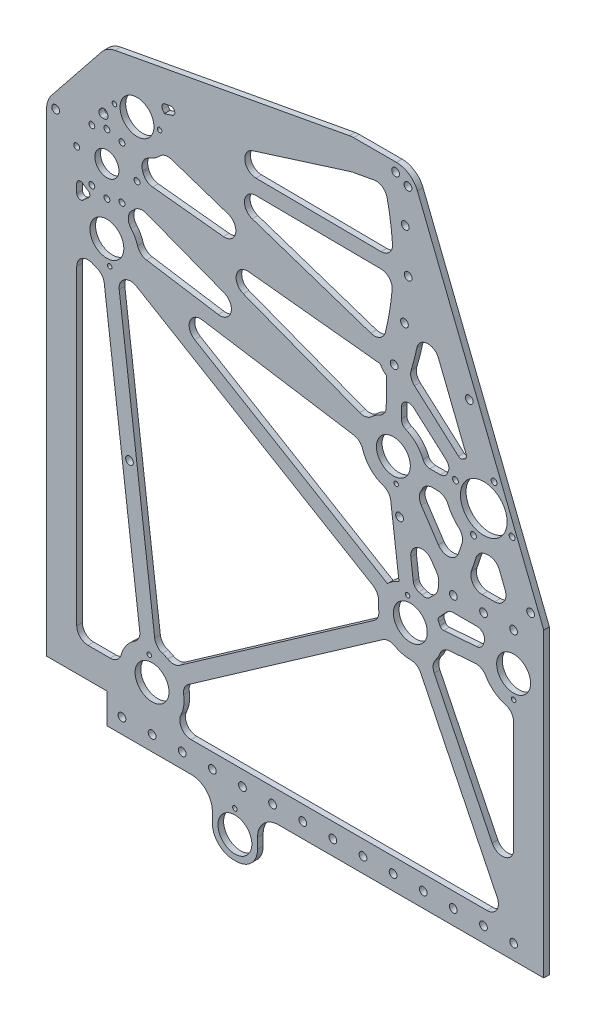
from build123d import *

# Parameters (mm, degrees)
SKETCH1_R           = 14.2875
SKETCH1_R_2         = 3.2639
SKETCH1_R_3         = 1.89865
SKETCH1_R_4         = 2.4892
SKETCH1_R_5         = 10.16
SKETCH1_R_6         = 19.685
BOSS_EXTRUDE1_DEPTH = 4.7625
CUT_EXTRUDE1_DEPTH  = 642.084706888


with BuildPart() as part:
    # Sketch1 → Boss-Extrude1 (new body)
    with BuildSketch(Plane.XY):
        with BuildLine():
            Line((0, 0), (58.42, 0))
            ThreePointArc((58.42, 0), (70.992358569, -5.207641431), (76.2, -17.78))
            Line((76.2, -17.78), (76.2, -26.67))
            ThreePointArc((76.2, -26.67), (81.407641431, -39.242358569), (93.98, -44.45))
            Line((93.98, -44.45), (96.52, -44.45))
            ThreePointArc((96.52, -44.45), (109.092358569, -39.242358569), (114.3, -26.67))
            Line((114.3, -26.67), (114.3, -17.78))
            ThreePointArc((114.3, -17.78), (119.507641431, -5.207641431), (132.08, 0))
            Line((132.08, 0), (355.6, 0))
            Line((355.6, 0), (355.6, 254))
            Line((355.6, 254), (249.10117554, 521.398701085))
            ThreePointArc((249.10117554, 521.398701085), (242.094897124, 530.116741193), (231.403200712, 533.4))
            Line((231.403200712, 533.4), (195.266336953, 533.4))
            ThreePointArc((195.266336953, 533.4), (193.528606236, 533.320577006), (191.805365363, 533.082970284))
            Line((191.805365363, 533.082970284), (-5.719746514, 496.589622449))
            ThreePointArc((-5.719746514, 496.589622449), (-12.042837413, 494.202129252), (-17.134325743, 489.757092821))
            Line((-17.134325743, 489.757092821), (-59.32555082, 437.018061475))
            ThreePointArc((-59.32555082, 437.018061475), (-62.42611948, 431.423303054), (-63.5, 425.117620819))
            Line((-63.5, 425.117620819), (-63.5, 25.4))
            Line((-63.5, 25.4), (-12.7, 25.4))
            Line((-12.7, 25.4), (-12.7, 0))
            Line((-12.7, 0), (0, 0))
        make_face()
        with Locations(Location((12.7, 457.2, 0), (0, 0, 180))):
            Circle(SKETCH1_R, mode=Mode.SUBTRACT)
        with Locations(Location((0, 12.7, 0), (0, 0, 180))):
            Circle(SKETCH1_R_2, mode=Mode.SUBTRACT)
        with Locations(Location((95.25, -25.4, 0), (0, 0, 180))):
            Circle(SKETCH1_R, mode=Mode.SUBTRACT)
        with Locations(Location((95.25, -6.35, 0), (0, 0, 180))):
            Circle(SKETCH1_R_3, mode=Mode.SUBTRACT)
        with Locations(Location((330.2, 209.55, 0), (0, 0, 180))):
            Circle(SKETCH1_R, mode=Mode.SUBTRACT)
        with Locations(Location((330.2, 241.3, 0), (0, 0, 180))):
            Circle(SKETCH1_R_2, mode=Mode.SUBTRACT)
        with Locations(Location((304.8, 241.3, 0), (0, 0, 180))):
            Circle(SKETCH1_R_2, mode=Mode.SUBTRACT)
        with Locations(Location((279.4, 241.3, 0), (0, 0, 180))):
            Circle(SKETCH1_R_2, mode=Mode.SUBTRACT)
        with Locations(Location((330.2, 190.5, 0), (0, 0, 180))):
            Circle(SKETCH1_R_3, mode=Mode.SUBTRACT)
        with Locations(Location((-6.35, 457.2, 0), (0, 0, 180))):
            Circle(SKETCH1_R_3, mode=Mode.SUBTRACT)
        with Locations(Location((31.75, 457.2, 0), (0, 0, 180))):
            Circle(SKETCH1_R_3, mode=Mode.SUBTRACT)
        with Locations(Location((-12.7, 435.695889306, 0), (0, 0, 180))):
            Circle(SKETCH1_R_4, mode=Mode.SUBTRACT)
        with Locations(Location((12.7, 410.295889306, 0), (0, 0, 180))):
            Circle(SKETCH1_R_4, mode=Mode.SUBTRACT)
        with Locations(Location((-12.7, 384.895889306, 0), (0, 0, 180))):
            Circle(SKETCH1_R_4, mode=Mode.SUBTRACT)
        with Locations(Location((-12.7, 410.295889306, 0), (0, 0, 180))):
            Circle(SKETCH1_R_5, mode=Mode.SUBTRACT)
        with Locations(Location((305.040932245, 317.5, 0), (0, 0, 180))):
            Circle(SKETCH1_R_6, mode=Mode.SUBTRACT)
        with Locations(Location((-12.7, 355.6, 0), (0, 0, 180))):
            Circle(SKETCH1_R, mode=Mode.SUBTRACT)
        with Locations(Location((25.4, 50.8, 0), (0, 0, 180))):
            Circle(SKETCH1_R, mode=Mode.SUBTRACT)
        with Locations(Location((228.840932245, 317.5, 0), (0, 0, 180))):
            Circle(SKETCH1_R, mode=Mode.SUBTRACT)
        with Locations(Location((243.128432245, 203.2, 0), (0, 0, 180))):
            Circle(SKETCH1_R, mode=Mode.SUBTRACT)
        with Locations(Location((313.728243886, 341.368192568, 0), (0, 0, 180))):
            Circle(SKETCH1_R_4, mode=Mode.SUBTRACT)
        with Locations(Location((328.909124813, 308.81268836, 0), (0, 0, 180))):
            Circle(SKETCH1_R_4, mode=Mode.SUBTRACT)
        with Locations(Location((296.353620605, 293.631807432, 0), (0, 0, 180))):
            Circle(SKETCH1_R_4, mode=Mode.SUBTRACT)
        with Locations(Location((281.172739677, 326.18731164, 0), (0, 0, 180))):
            Circle(SKETCH1_R_4, mode=Mode.SUBTRACT)
        with Locations(Location((241.146330981, 520.7, 0), (0, 0, 180))):
            Circle(SKETCH1_R_2, mode=Mode.SUBTRACT)
        with Locations(Location((6.35, 203.2, 0), (0, 0, 180))):
            Circle(SKETCH1_R_2, mode=Mode.SUBTRACT)
        with Locations(Location((234.039227972, 275.913634187, 0), (0, 0, 180))):
            Circle(SKETCH1_R_2, mode=Mode.SUBTRACT)
        with Locations(Location((25.4, 12.7, 0), (0, 0, 180))):
            Circle(SKETCH1_R_2, mode=Mode.SUBTRACT)
        with Locations(Location((50.8, 12.7, 0), (0, 0, 180))):
            Circle(SKETCH1_R_2, mode=Mode.SUBTRACT)
        with Locations(Location((0, 388.29884405, 0), (0, 0, 180))):
            Circle(SKETCH1_R_4, mode=Mode.SUBTRACT)
        with Locations(Location((-25.4, 388.29884405, 0), (0, 0, 180))):
            Circle(SKETCH1_R_4, mode=Mode.SUBTRACT)
        with Locations(Location((-10.337138306, 336.697106449, 0), (0, 0, 180))):
            Circle(SKETCH1_R_3, mode=Mode.SUBTRACT)
        with Locations(Location((23.037138306, 69.702893551, 0), (0, 0, 180))):
            Circle(SKETCH1_R_3, mode=Mode.SUBTRACT)
        with Locations(Location((231.203793939, 298.597106449, 0), (0, 0, 180))):
            Circle(SKETCH1_R_3, mode=Mode.SUBTRACT)
        with Locations(Location((240.765570551, 222.102893551, 0), (0, 0, 180))):
            Circle(SKETCH1_R_3, mode=Mode.SUBTRACT)
        with Locations(Location((292.836805605, 390.914851261, 0), (0, 0, 180))):
            Circle(SKETCH1_R_2, mode=Mode.SUBTRACT)
        with Locations(Location((344.52728023, 261.129702523, 0), (0, 0, 180))):
            Circle(SKETCH1_R_2, mode=Mode.SUBTRACT)
        with Locations(Location((229.48678758, 384.664155546, 0), (0, 0, 180))):
            Circle(SKETCH1_R_2, mode=Mode.SUBTRACT)
        with Locations(Location((238.164888511, 419.4701173, 0), (0, 0, 180))):
            Circle(SKETCH1_R_2, mode=Mode.SUBTRACT)
        with Locations(Location((241.291295612, 455.205113985, 0), (0, 0, 180))):
            Circle(SKETCH1_R_2, mode=Mode.SUBTRACT)
        with Locations(Location((238.789026365, 490.989231384, 0), (0, 0, 180))):
            Circle(SKETCH1_R_2, mode=Mode.SUBTRACT)
        with Locations(Location((230.719694941, 525.941345767, 0), (0, 0, 180))):
            Circle(SKETCH1_R_2, mode=Mode.SUBTRACT)
        with Locations(Location((-55.88, 428.625, 0), (0, 0, 180))):
            Circle(SKETCH1_R_2, mode=Mode.SUBTRACT)
        with Locations(Location((76.2, 12.7, 0), (0, 0, 180))):
            Circle(SKETCH1_R_2, mode=Mode.SUBTRACT)
        with Locations(Location((101.6, 12.7, 0), (0, 0, 180))):
            Circle(SKETCH1_R_2, mode=Mode.SUBTRACT)
        with Locations(Location((127, 12.7, 0), (0, 0, 180))):
            Circle(SKETCH1_R_2, mode=Mode.SUBTRACT)
        with Locations(Location((152.4, 12.7, 0), (0, 0, 180))):
            Circle(SKETCH1_R_2, mode=Mode.SUBTRACT)
        with Locations(Location((177.8, 12.7, 0), (0, 0, 180))):
            Circle(SKETCH1_R_2, mode=Mode.SUBTRACT)
        with Locations(Location((203.2, 12.7, 0), (0, 0, 180))):
            Circle(SKETCH1_R_2, mode=Mode.SUBTRACT)
        with Locations(Location((228.6, 12.7, 0), (0, 0, 180))):
            Circle(SKETCH1_R_2, mode=Mode.SUBTRACT)
        with Locations(Location((254, 12.7, 0), (0, 0, 180))):
            Circle(SKETCH1_R_2, mode=Mode.SUBTRACT)
        with Locations(Location((279.4, 12.7, 0), (0, 0, 180))):
            Circle(SKETCH1_R_2, mode=Mode.SUBTRACT)
        with Locations(Location((304.8, 12.7, 0), (0, 0, 180))):
            Circle(SKETCH1_R_2, mode=Mode.SUBTRACT)
        with Locations(Location((330.2, 12.7, 0), (0, 0, 180))):
            Circle(SKETCH1_R_2, mode=Mode.SUBTRACT)
        with Locations(Location((-38.1, 410.295889306, 0), (0, 0, 180))):
            Circle(SKETCH1_R_4, mode=Mode.SUBTRACT)
        with Locations(Location((-25.4, 432.292934562, 0), (0, 0, 180))):
            Circle(SKETCH1_R_4, mode=Mode.SUBTRACT)
        with Locations(Location((0, 432.292934562, 0), (0, 0, 180))):
            Circle(SKETCH1_R_4, mode=Mode.SUBTRACT)
    extrude(amount=BOSS_EXTRUDE1_DEPTH)

    # Sketch2 → Cut-Extrude1 (cut, through all)
    with BuildSketch(Plane.XY.offset(4.7625)):
        with BuildLine():
            Line((-38.1, 60.325), (-38.1, 322.719199656))
            ThreePointArc((-38.1, 322.719199656), (-33.638580803, 330.786775157), (-24.433695652, 331.296799746))
            ThreePointArc((-24.433695652, 331.296799746), (-22.900882798, 330.614661371), (-21.328645615, 330.029086229))
            ThreePointArc((-21.328645615, 330.029086229), (-16.996833162, 327.029196632), (-14.922603173, 322.185488686))
            Line((-14.922603173, 322.185488686), (15.020674139, 82.639270185))
            ThreePointArc((15.020674139, 82.639270185), (14.202563952, 77.434019717), (10.742472399, 73.46014212))
            ThreePointArc((10.742472399, 73.46014212), (3.597868561, 66.705729187), (-0.653032363, 57.840217391))
            ThreePointArc((-0.653032363, 57.840217391), (-4.057794078, 52.762157302), (-9.848220256, 50.8))
            Line((-9.848220256, 50.8), (-28.575, 50.8))
            ThreePointArc((-28.575, 50.8), (-35.310192091, 53.589807909), (-38.1, 60.325))
        make_face()
        with BuildLine():
            Line((-18.799176664, 447.016190262), (-17.864744515, 448.184230449))
            ThreePointArc((-17.864744515, 448.184230449), (-14.908714143, 449.339822487), (-12.429119093, 447.358631707))
            ThreePointArc((-12.429119093, 447.358631707), (-12.2388309, 446.885938258), (-12.039651987, 446.416921783))
            ThreePointArc((-12.039651987, 446.416921783), (-12.239530994, 443.495175095), (-14.745635708, 441.97992116))
            ThreePointArc((-14.745635708, 441.97992116), (-15.368752024, 441.933529272), (-15.990834722, 441.874884015))
            ThreePointArc((-15.990834722, 441.874884015), (-19.106326386, 443.510760362), (-18.799176664, 447.016190262))
        make_face()
        with BuildLine():
            Line((36.19057906, 478.502818876), (40.824911192, 479.359025425))
            ThreePointArc((40.824911192, 479.359025425), (44.482646234, 477.004092806), (42.356480703, 473.208812393))
            Line((42.356480703, 473.208812393), (35.80632756, 471.14355704))
            ThreePointArc((35.80632756, 471.14355704), (35.050371679, 472.325674929), (34.233996326, 473.466903777))
            ThreePointArc((34.233996326, 473.466903777), (33.807929946, 476.530490485), (36.19057906, 478.502818876))
        make_face()
        with BuildLine():
            Line((266.824182793, 408.252842493), (290.231086719, 349.482468849))
            ThreePointArc((290.231086719, 349.482468849), (290.280530625, 347.265578846), (288.867094604, 345.556999144))
            ThreePointArc((288.867094604, 345.556999144), (288.170576423, 345.143793506), (287.484608388, 344.713300381))
            ThreePointArc((287.484608388, 344.713300381), (285.519595212, 344.215645611), (283.653958733, 345.008323085))
            Line((283.653958733, 345.008323085), (246.600461466, 377.947175943))
            ThreePointArc((246.600461466, 377.947175943), (243.764810838, 382.46848463), (243.806173651, 387.80528478))
            ThreePointArc((243.806173651, 387.80528478), (246.425000245, 397.214049473), (248.660947453, 406.721080864))
            ThreePointArc((248.660947453, 406.721080864), (257.174764084, 414.21980033), (266.824182793, 408.252842493))
        make_face()
        with BuildLine():
            Line((307.859067954, 25.4), (58.280800344, 25.4))
            ThreePointArc((58.280800344, 25.4), (50.213224843, 29.861419197), (49.703200254, 39.066304348))
            ThreePointArc((49.703200254, 39.066304348), (52.106434653, 46.91522145), (52.038922024, 55.123539018))
            ThreePointArc((52.038922024, 55.123539018), (52.666309831, 60.355204265), (55.978903868, 64.452844739))
            Line((55.978903868, 64.452844739), (219.832182558, 179.142687562))
            ThreePointArc((219.832182558, 179.142687562), (224.816259843, 180.85233967), (229.946588598, 179.650814148))
            ThreePointArc((229.946588598, 179.650814148), (236.390004583, 177.067285849), (243.279292634, 176.212921659))
            ThreePointArc((243.279292634, 176.212921659), (248.350941339, 174.783825397), (251.886853617, 170.877258991))
            Line((251.886853617, 170.877258991), (316.413384094, 39.114188511))
            ThreePointArc((316.413384094, 39.114188511), (315.940764731, 29.883987977), (307.859067954, 25.4))
        make_face()
        with BuildLine():
            Line((303.628265017, 254), (314.213336557, 254))
            ThreePointArc((314.213336557, 254), (322.096707153, 258.179151794), (323.062323971, 267.049350543))
            Line((323.062323971, 267.049350543), (318.169842434, 279.333459918))
            ThreePointArc((318.169842434, 279.333459918), (314.256652531, 283.955490654), (308.348145298, 285.28431179))
            ThreePointArc((308.348145298, 285.28431179), (307.728913526, 285.226745103), (307.108690506, 285.181079833))
            ThreePointArc((307.108690506, 285.181079833), (301.914252062, 283.229019405), (298.689245961, 278.71326185))
            Line((298.689245961, 278.71326185), (294.600656278, 266.562746772))
            ThreePointArc((294.600656278, 266.562746772), (295.893274293, 257.966624023), (303.628265017, 254))
        make_face()
        with BuildLine():
            Line((279.4, 228.6), (299.376325556, 228.6))
            ThreePointArc((299.376325556, 228.6), (304.652851514, 225.782813866), (305.24750164, 219.830952381))
            ThreePointArc((305.24750164, 219.830952381), (304.889888033, 218.916076472), (304.565805272, 217.988792382))
            ThreePointArc((304.565805272, 217.988792382), (302.441476402, 214.968801127), (298.996099488, 213.641209982))
            Line((298.996099488, 213.641209982), (271.209822072, 211.614798076))
            ThreePointArc((271.209822072, 211.614798076), (269.31406891, 212.077871306), (268.047260495, 213.562294866))
            ThreePointArc((268.047260495, 213.562294866), (267.529427929, 214.728944701), (266.957011707, 215.869804934))
            ThreePointArc((266.957011707, 215.869804934), (266.614718788, 217.791042146), (267.460809703, 219.549577625))
            Line((267.460809703, 219.549577625), (274.208695443, 226.637621032))
            ThreePointArc((274.208695443, 226.637621032), (276.396893604, 228.133720202), (279.005216021, 228.606137483))
            ThreePointArc((279.005216021, 228.606137483), (279.202584158, 228.601534463), (279.4, 228.6))
        make_face()
        with BuildLine():
            Line((223.843870327, 222.079375728), (61.310257234, 318.902556865))
            ThreePointArc((61.310257234, 318.902556865), (57.227247599, 330.323556905), (67.669100269, 336.494288014))
            Line((67.669100269, 336.494288014), (195.372309265, 316.350736287))
            ThreePointArc((195.372309265, 316.350736287), (200.146965701, 314.122150942), (203.00631261, 309.696309557))
            ThreePointArc((203.00631261, 309.696309557), (209.454139857, 298.72561753), (220.212286631, 291.929086229))
            ThreePointArc((220.212286631, 291.929086229), (224.544099083, 288.929196632), (226.618329072, 284.085488686))
            Line((226.618329072, 284.085488686), (233.57406086, 228.439634381))
            ThreePointArc((233.57406086, 228.439634381), (228.362449682, 225.789619634), (223.843870327, 222.079375728))
        make_face()
        with BuildLine():
            Line((12.298525281, 333.316749227), (211.630246523, 214.57250313))
            ThreePointArc((211.630246523, 214.57250313), (215.23455266, 210.728948267), (216.244091901, 205.557413945))
            ThreePointArc((216.244091901, 205.557413945), (216.159122155, 202.209308581), (216.489510221, 198.876460982))
            ThreePointArc((216.489510221, 198.876460982), (215.862122415, 193.644795735), (212.549528377, 189.547155261))
            Line((212.549528377, 189.547155261), (48.696249688, 74.857312438))
            ThreePointArc((48.696249688, 74.857312438), (43.712172403, 73.14766033), (38.581843648, 74.349185852))
            ThreePointArc((38.581843648, 74.349185852), (36.351995545, 75.465339038), (34.028645615, 76.370913771))
            ThreePointArc((34.028645615, 76.370913771), (29.696833162, 79.370803368), (27.622603173, 84.214511314))
            Line((27.622603173, 84.214511314), (-2.320674139, 323.760729815))
            ThreePointArc((-2.320674139, 323.760729815), (-1.502563952, 328.965980283), (1.957527601, 332.93985788))
            ThreePointArc((1.957527601, 332.93985788), (2.065982563, 333.010380366), (2.174098224, 333.08142193))
            ThreePointArc((2.174098224, 333.08142193), (7.202445228, 334.656116543), (12.298525281, 333.316749227))
        make_face()
        with BuildLine():
            Line((263.292608469, 176.462843673), (312.12068386, 76.755992994))
            ThreePointArc((312.12068386, 76.755992994), (322.825088809, 71.666025126), (330.2, 80.945181505))
            Line((330.2, 80.945181505), (330.2, 174.301779744))
            ThreePointArc((330.2, 174.301779744), (328.237842698, 180.092205922), (323.159782609, 183.496967637))
            ThreePointArc((323.159782609, 183.496967637), (313.737608962, 188.165079201), (306.814626608, 196.07968198))
            ThreePointArc((306.814626608, 196.07968198), (303.024336294, 199.739960118), (297.86816124, 200.825223002))
            Line((297.86816124, 200.825223002), (276.384009899, 199.258415782))
            ThreePointArc((276.384009899, 199.258415782), (271.439847396, 197.436550295), (268.220714464, 193.265085339))
            ThreePointArc((268.220714464, 193.265085339), (266.531184332, 189.759897656), (264.355143992, 186.534110745))
            ThreePointArc((264.355143992, 186.534110745), (262.37449565, 181.651389285), (263.292608469, 176.462843673))
        make_face()
        with BuildLine():
            Line((20.76862298, 356.749263713), (81.284151638, 347.203711245))
            ThreePointArc((81.284151638, 347.203711245), (91.969128506, 354.14875677), (86.184174765, 365.503786415))
            Line((86.184174765, 365.503786415), (20.5883354, 390.704584442))
            ThreePointArc((20.5883354, 390.704584442), (15.082567769, 391.106090133), (10.278776905, 388.386112677))
            ThreePointArc((10.278776905, 388.386112677), (9.402605923, 387.50252818), (8.492485051, 386.653954584))
            ThreePointArc((8.492485051, 386.653954584), (5.343572324, 380.152199071), (7.663213897, 373.310580907))
            ThreePointArc((7.663213897, 373.310580907), (10.924067716, 368.64716754), (13.134619636, 363.403690443))
            ThreePointArc((13.134619636, 363.403690443), (15.993966545, 358.977849058), (20.76862298, 356.749263713))
        make_face()
        with BuildLine():
            Line((102.332438022, 372.904893306), (200.424619589, 335.219557169))
            ThreePointArc((200.424619589, 335.219557169), (205.674047392, 334.764096458), (210.36238516, 337.168971856))
            ThreePointArc((210.36238516, 337.168971856), (213.66525321, 339.816449584), (217.341469568, 341.91490353))
            ThreePointArc((217.341469568, 341.91490353), (221.301348703, 345.3910068), (222.807395329, 350.440339457))
            Line((222.807395329, 350.440339457), (223.031323456, 373.727200625))
            ThreePointArc((223.031323456, 373.727200625), (220.005048323, 376.215095205), (217.88103223, 379.506981633))
            Line((217.88103223, 379.506981633), (106.750838987, 391.268397499))
            ThreePointArc((106.750838987, 391.268397499), (96.48765307, 384.024496514), (102.332438022, 372.904893306))
        make_face()
        with BuildLine():
            Line((259.782663126, 229.903145882), (264.07598925, 234.412896506))
            ThreePointArc((264.07598925, 234.412896506), (266.046572769, 237.507542886), (266.70131221, 241.117439268))
            ThreePointArc((266.70131221, 241.117439268), (266.748590381, 242.409880464), (266.927068545, 243.690811772))
            ThreePointArc((266.927068545, 243.690811772), (266.910869371, 247.35956813), (265.509212287, 250.750053794))
            Line((265.509212287, 250.750053794), (260.912298524, 257.678283373))
            ThreePointArc((260.912298524, 257.678283373), (249.663919213, 261.342959094), (243.524009416, 251.230719334))
            Line((243.524009416, 251.230719334), (245.606190484, 234.573270795))
            ThreePointArc((245.606190484, 234.573270795), (247.109566657, 231.200885821), (250.235017333, 229.235007291))
            ThreePointArc((250.235017333, 229.235007291), (251.572479808, 228.832464123), (252.887324578, 228.361263416))
            ThreePointArc((252.887324578, 228.361263416), (256.569250576, 228.08460248), (259.782663126, 229.903145882))
        make_face()
        with BuildLine():
            Line((283.724892869, 274.063491541), (286.652434309, 282.763590879))
            ThreePointArc((286.652434309, 282.763590879), (286.813424876, 288.310374874), (283.855758905, 293.005579094))
            ThreePointArc((283.855758905, 293.005579094), (278.741963784, 298.601521679), (275.069148501, 305.232954545))
            ThreePointArc((275.069148501, 305.232954545), (271.562395074, 309.533583693), (266.253917988, 311.15))
            Line((266.253917988, 311.15), (261.721732589, 311.15))
            ThreePointArc((261.721732589, 311.15), (256.658151787, 309.692575501), (253.144132499, 305.766304348))
            ThreePointArc((253.144132499, 305.766304348), (252.621153402, 304.739661526), (252.054830607, 303.736276699))
            ThreePointArc((252.054830607, 303.736276699), (250.726022052, 298.637433248), (252.311128873, 293.612358812))
            Line((252.311128873, 293.612358812), (266.760441798, 271.835105121))
            ThreePointArc((266.760441798, 271.835105121), (275.937795858, 267.657364338), (283.724892869, 274.063491541))
        make_face()
        with BuildLine():
            Line((259.66460669, 323.85), (268.447077228, 323.85))
            ThreePointArc((268.447077228, 323.85), (272.128246078, 325.025882114), (274.446069854, 328.118032787))
            ThreePointArc((274.446069854, 328.118032787), (274.770179092, 329.00954945), (275.120260303, 329.891191046))
            ThreePointArc((275.120260303, 329.891191046), (275.442350268, 333.742159872), (273.472344751, 337.066732191))
            Line((273.472344751, 337.066732191), (246.136593202, 361.366956582))
            ThreePointArc((246.136593202, 361.366956582), (239.344380627, 362.426271694), (235.568003902, 356.682119972))
            Line((235.568003902, 356.682119972), (235.487027637, 348.261190196))
            ThreePointArc((235.487027637, 348.261190196), (236.52648183, 344.718217531), (239.361343246, 342.352486971))
            ThreePointArc((239.361343246, 342.352486971), (248.015504723, 336.491074918), (253.793430605, 327.780952381))
            ThreePointArc((253.793430605, 327.780952381), (256.131792824, 324.923474042), (259.66460669, 323.85))
        make_face()
        with BuildLine():
            Line((25.856714785, 412.6007201), (85.52392649, 406.285866594))
            ThreePointArc((85.52392649, 406.285866594), (95.833797835, 413.733612223), (89.548728883, 424.79074885))
            Line((89.548728883, 424.79074885), (41.8667562, 440.744913734))
            ThreePointArc((41.8667562, 440.744913734), (36.602395165, 440.969501372), (32.024143431, 438.361140244))
            ThreePointArc((32.024143431, 438.361140244), (27.761424924, 434.806281338), (22.861615654, 432.198665565))
            ThreePointArc((22.861615654, 432.198665565), (17.79478392, 427.35540575), (17.413898644, 420.356486129))
            ThreePointArc((17.413898644, 420.356486129), (17.5761632, 419.857083892), (17.730146405, 419.355066409))
            ThreePointArc((17.730146405, 419.355066409), (20.770904839, 414.747629793), (25.856714785, 412.6007201))
        make_face()
        with BuildLine():
            Line((218.40026883, 449.054639152), (112.871575313, 449.975574108))
            ThreePointArc((112.871575313, 449.975574108), (103.394084708, 442.023015237), (109.76612821, 431.418153975))
            Line((109.76612821, 431.418153975), (209.845295283, 397.932133093))
            ThreePointArc((209.845295283, 397.932133093), (217.442605846, 398.610566799), (222.106127772, 404.646373566))
            ThreePointArc((222.106127772, 404.646373566), (225.639061372, 421.566221895), (227.807170821, 438.714463458))
            ThreePointArc((227.807170821, 438.714463458), (225.362790682, 445.939725101), (218.40026883, 449.054639152))
        make_face()
        with BuildLine():
            Line((112.982402314, 462.675090531), (218.511095831, 461.754155575))
            ThreePointArc((218.511095831, 461.754155575), (225.526920003, 464.747082447), (228.097026054, 471.928583333))
            ThreePointArc((228.097026054, 471.928583333), (226.401747873, 487.930651735), (223.519328967, 503.76200741))
            ThreePointArc((223.519328967, 503.76200741), (219.481077262, 509.646985998), (212.487990423, 511.074286342))
            Line((212.487990423, 511.074286342), (194.216013982, 507.698484726))
            ThreePointArc((194.216013982, 507.698484726), (193.644812493, 507.574718916), (193.082277037, 507.41615354))
            Line((193.082277037, 507.41615354), (110.201299824, 481.283881804))
            ThreePointArc((110.201299824, 481.283881804), (103.645146466, 470.791843207), (112.982402314, 462.675090531))
        make_face()
        with BuildLine():
            Line((-38.1, 375.991806719), (-38.1, 383.355120943))
            ThreePointArc((-38.1, 383.355120943), (-36.278824549, 386.2270165), (-32.904545455, 385.804281703))
            ThreePointArc((-32.904545455, 385.804281703), (-30.850085999, 384.245229464), (-28.675867755, 382.858065969))
            ThreePointArc((-28.675867755, 382.858065969), (-27.102011936, 380.264539659), (-28.423617211, 377.533832726))
            ThreePointArc((-28.423617211, 377.533832726), (-30.599834991, 375.797055814), (-32.585526316, 373.845300748))
            ThreePointArc((-32.585526316, 373.845300748), (-36.076693547, 373.033052424), (-38.1, 375.991806719))
        make_face()
    extrude(amount=-CUT_EXTRUDE1_DEPTH, mode=Mode.SUBTRACT)


solid = part.part
